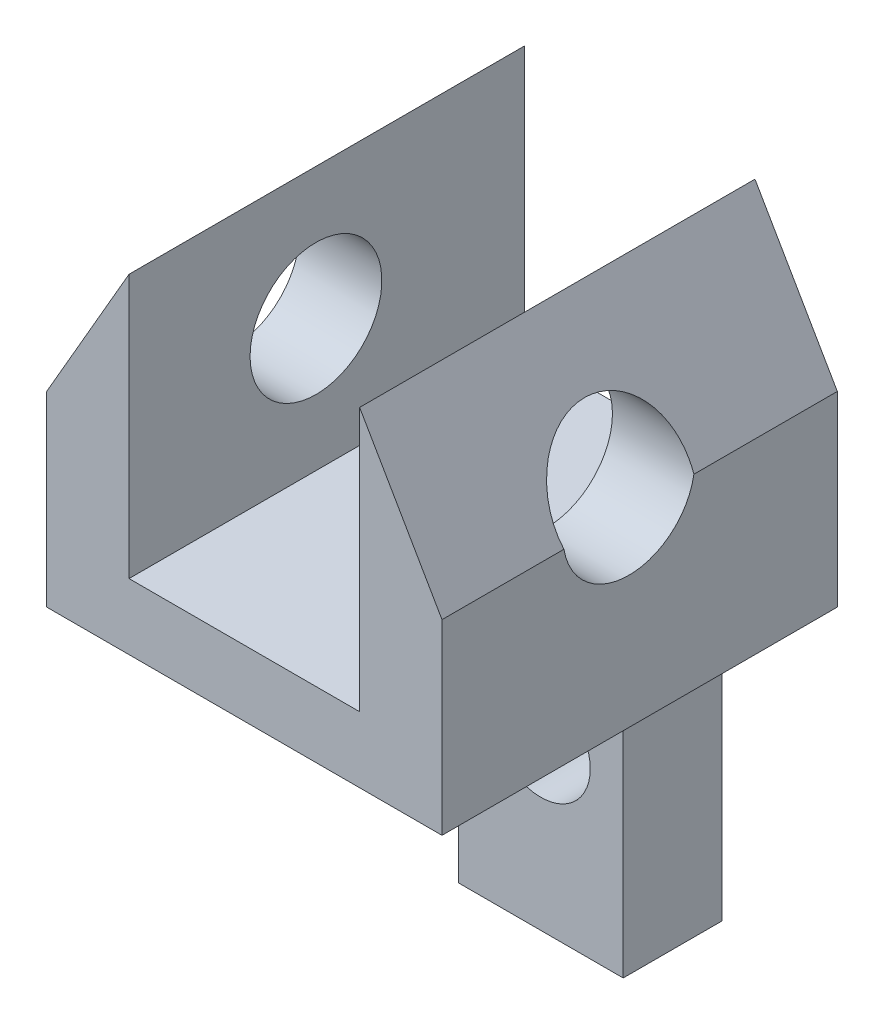
from build123d import *

# Parameters (mm, degrees)
SKETCH1_W                 = 12
SKETCH1_H                 = 12
BOSS_EXTRUDE1_DEPTH       = 2
SKETCH2_W                 = 2.5
SKETCH2_H                 = 12
BOSS_EXTRUDE2_DEPTH       = 8
CUT_EXTRUDE1_DEPTH        = 17.733200531
CUT_EXTRUDE2_DEPTH        = 16.041608956
CUT_EXTRUDE2_DEPTH_BACK   = 16.041608956
SKETCH4_R                 = 2
SKETCH6_W                 = 5
SKETCH6_H                 = 3
BOSS_EXTRUDE3_DEPTH       = 10
F_3_0MM_DOWEL_HOLE1_D     = 3
F_3_0MM_DOWEL_HOLE1_DEPTH = 3
F_3_0MM_DOWEL_HOLE1_TIP   = 0.901290929


with BuildPart() as part:
    # Sketch1 → Boss-Extrude1 (new body)
    with BuildSketch(Plane(origin=(0, 0, 0), x_dir=(1, 0, 0), z_dir=(0, 1, 0))):
        Rectangle(SKETCH1_W, SKETCH1_H)
    extrude(amount=BOSS_EXTRUDE1_DEPTH)

    # Sketch2 → Boss-Extrude2 (add)
    with BuildSketch(Plane(origin=(0, 2, 0), x_dir=(1, 0, 0), z_dir=(0, 1, 0))):
        with Locations((-4.75, 0)):
            Rectangle(SKETCH2_W, SKETCH2_H)
        with Locations((4.75, 0)):
            Rectangle(SKETCH2_W, SKETCH2_H)
    extrude(amount=BOSS_EXTRUDE2_DEPTH)

    # Sketch5 → Cut-Extrude1 (cut, through all)
    with BuildSketch(Plane.XY.offset(6)):
        Polygon((-3.5, 10), (-6, 5.669872981), (-6, 10), align=None)
        Polygon((3.5, 10), (6, 5.669872981), (6, 10), align=None)
    extrude(amount=-CUT_EXTRUDE1_DEPTH, mode=Mode.SUBTRACT)

    # Sketch4 → Cut-Extrude2 (cut, two sides: drawn at the far end of the back side and taken through both)
    with BuildSketch(Plane.ZY.offset(-3.5).offset(-CUT_EXTRUDE2_DEPTH_BACK)):
        with Locations((0.326138493, 6)):
            Circle(SKETCH4_R)
    extrude(amount=CUT_EXTRUDE2_DEPTH + CUT_EXTRUDE2_DEPTH_BACK, mode=Mode.SUBTRACT)

    # Sketch6 → Boss-Extrude3 (add)
    with BuildSketch(Plane.XZ):
        with Locations((0, -4.5)):
            Rectangle(SKETCH6_W, SKETCH6_H)
    extrude(amount=BOSS_EXTRUDE3_DEPTH)

    # Ø3.0mm Dowel Hole1
    with Locations(Plane.XY.offset(-3)):
        with Locations((0, -5)):
            Hole(F_3_0MM_DOWEL_HOLE1_D / 2, depth=F_3_0MM_DOWEL_HOLE1_DEPTH)
            with Locations((0, 0, -(F_3_0MM_DOWEL_HOLE1_DEPTH + F_3_0MM_DOWEL_HOLE1_TIP / 2))):  # 118° drill point
                Cone(0, F_3_0MM_DOWEL_HOLE1_D / 2, F_3_0MM_DOWEL_HOLE1_TIP, mode=Mode.SUBTRACT)


solid = part.part
